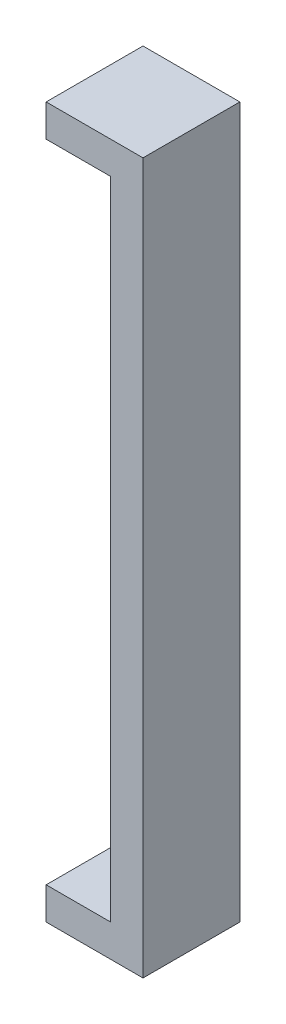
from build123d import *

# Parameters (mm, degrees)
SALIENTE_EXTRUIR1_DEPTH = 33
CROQUIS2_W              = 6
CROQUIS2_H              = 3
SALIENTE_EXTRUIR2_DEPTH = 6


with BuildPart() as part:
    # Croquis1 → Saliente-Extruir1 (new, symmetric)
    with BuildSketch(Plane(origin=(0, 0, 0), x_dir=(1, 0, 0), z_dir=(0, 1, 0))):
        Polygon((-3.06, 6.21), (5.94, 6.21), (5.94, -2.79), (2.94, -2.79), (2.94, 3.21), (-3.06, 3.21), align=None)
    extrude(amount=SALIENTE_EXTRUIR1_DEPTH, both=True)

    # Croquis2 → Saliente-Extruir2 (add, through all)
    with BuildSketch(Plane.XY.offset(-3.21)):
        with Locations((-0.06, 31.5)):
            Rectangle(CROQUIS2_W, CROQUIS2_H)
    saliente_extruir2 = extrude(amount=SALIENTE_EXTRUIR2_DEPTH)

    # Simetría1: Saliente-Extruir2 across plane
    add(saliente_extruir2.mirror(Plane.ZX))


solid = part.part
